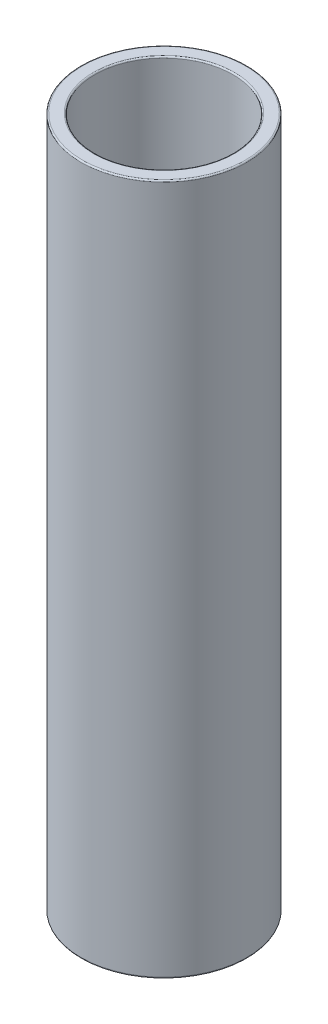
from build123d import *

# Parameters (mm, degrees)
SKETCH1_R           = 3
SKETCH1_R_2         = 2.5
BOSS_EXTRUDE1_DEPTH = 12.5
FILLET1_R           = 0.05


with BuildPart() as part:
    # Sketch1 → Boss-Extrude1 (new, symmetric)
    with BuildSketch(Plane(origin=(0, 0, 0), x_dir=(1, 0, 0), z_dir=(0, 1, 0))):
        with Locations(Location((0, 0, 0), (0, 0, 270))):
            Circle(SKETCH1_R)
        with Locations(Location((0, 0, 0), (0, 0, 270))):
            Circle(SKETCH1_R_2, mode=Mode.SUBTRACT)
    extrude(amount=BOSS_EXTRUDE1_DEPTH, both=True)

    # Fillet1
    fillet1_edges = [part.edges().sort_by_distance(p)[0] for p in [
        (0, -12.5, -3),
        (0, 12.5, -3),
        (0, -12.5, -2.5),
        (0, 12.5, -2.5),
    ]]
    fillet(fillet1_edges, radius=FILLET1_R)


solid = part.part
